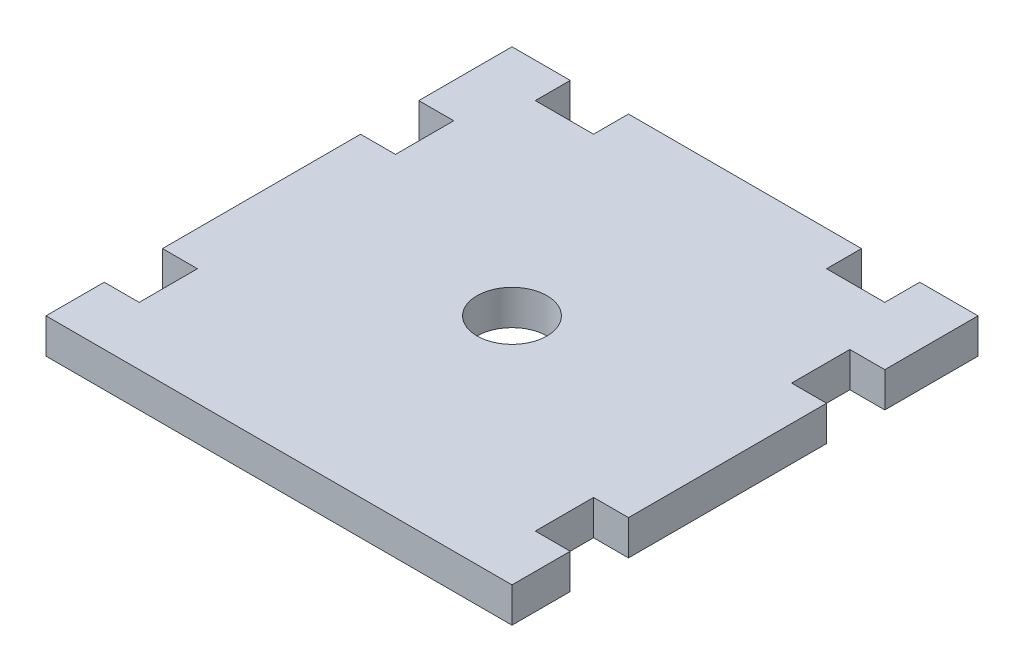
from build123d import *

# Parameters (mm, degrees)
SKETCH1_W           = 40
SKETCH1_H           = 40
BOSS_EXTRUDE1_DEPTH = 3
SKETCH2_R           = 3
CUT_EXTRUDE1_DEPTH  = 3
SKETCH3_W           = 5
SKETCH3_H           = 3
CUT_EXTRUDE2_DEPTH  = 10
SKETCH4_W           = 3
SKETCH4_H           = 5
CUT_EXTRUDE3_DEPTH  = 3


with BuildPart() as part:
    # Sketch1 → Boss-Extrude1 (new body)
    with BuildSketch(Plane(origin=(0, 0, 0), x_dir=(1, 0, 0), z_dir=(0, 1, 0))):
        Rectangle(SKETCH1_W, SKETCH1_H)
    extrude(amount=BOSS_EXTRUDE1_DEPTH)

    # Sketch2 → Cut-Extrude1 (cut)
    with BuildSketch(Plane(origin=(0, 3, 0), x_dir=(1, 0, 0), z_dir=(0, 1, 0))):
        with Locations(Location((0, 0, 0), (0, 0, 270))):
            Circle(SKETCH2_R)
    extrude(amount=-CUT_EXTRUDE1_DEPTH, mode=Mode.SUBTRACT)

    # Sketch3 → Cut-Extrude2 (cut)
    with BuildSketch(Plane.XZ):
        with Locations((12.5, -18.5)):
            Rectangle(SKETCH3_W, SKETCH3_H)
        with Locations((-12.5, -18.5)):
            Rectangle(SKETCH3_W, SKETCH3_H)
    extrude(amount=-CUT_EXTRUDE2_DEPTH, mode=Mode.SUBTRACT)

    # Sketch4 → Cut-Extrude3 (cut)
    with BuildSketch(Plane.XZ):
        with Locations((18.5, 12.5)):
            Rectangle(SKETCH4_W, SKETCH4_H)
        with Locations((18.5, -9.5)):
            Rectangle(SKETCH4_W, SKETCH4_H)
        with Locations((-18.5, -9.5)):
            Rectangle(SKETCH4_W, SKETCH4_H)
        with Locations((-18.5, 12.5)):
            Rectangle(SKETCH4_W, SKETCH4_H)
    extrude(amount=-CUT_EXTRUDE3_DEPTH, mode=Mode.SUBTRACT)


solid = part.part
